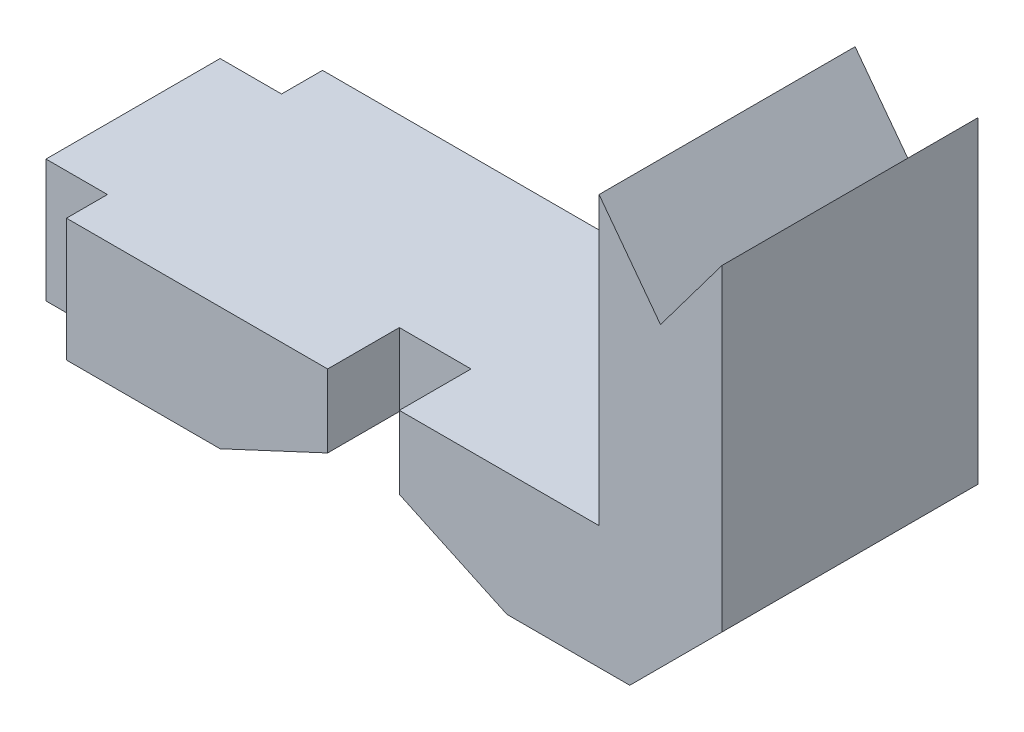
from build123d import *

# Parameters (mm, degrees)
EXTRUDE_1_DEPTH     = 25
CUT_EXTRUDE_1_DEPTH = 48.434164903
SKETCH_3_W          = 6
SKETCH_3_H          = 4
SKETCH_3_W_2        = 7
SKETCH_3_H_2        = 7
CUT_EXTRUDE_2_DEPTH = 52.322509681


with BuildPart() as part:
    # Эскиз1 → Бобышка-Вытянуть1 (new body)
    with BuildSketch(Plane.XY):
        Polygon((23, -8), (-35, -8), (-35, -20), (35, -20), (35, 20), (23, 20), align=None)
    extrude(amount=EXTRUDE_1_DEPTH)

    # Эскиз2 → Вырез-Вытянуть1 (cut, through all)
    with BuildSketch(Plane.XY.offset(25)):
        Polygon((35, -20), (35, -11), (26, -20), align=None)
        Polygon((-14, -20), (14, -20), (0, -13.471692786), align=None)
        Polygon((23, 20), (29, 12), (35, 20), align=None)
    extrude(amount=-CUT_EXTRUDE_1_DEPTH, mode=Mode.SUBTRACT)

    # Эскиз3 → Вырез-Вытянуть2 (cut, through all)
    with BuildSketch(Plane(origin=(0, -8, 0), x_dir=(1, 0, 0), z_dir=(0, 1, 0))):
        with Locations((-32, -23)):
            Rectangle(SKETCH_3_W, SKETCH_3_H)
        with Locations((-32, -2)):
            Rectangle(SKETCH_3_W, SKETCH_3_H)
        with Locations((0, -21.5)):
            Rectangle(SKETCH_3_W_2, SKETCH_3_H_2)
    extrude(amount=-CUT_EXTRUDE_2_DEPTH, mode=Mode.SUBTRACT)


solid = part.part
